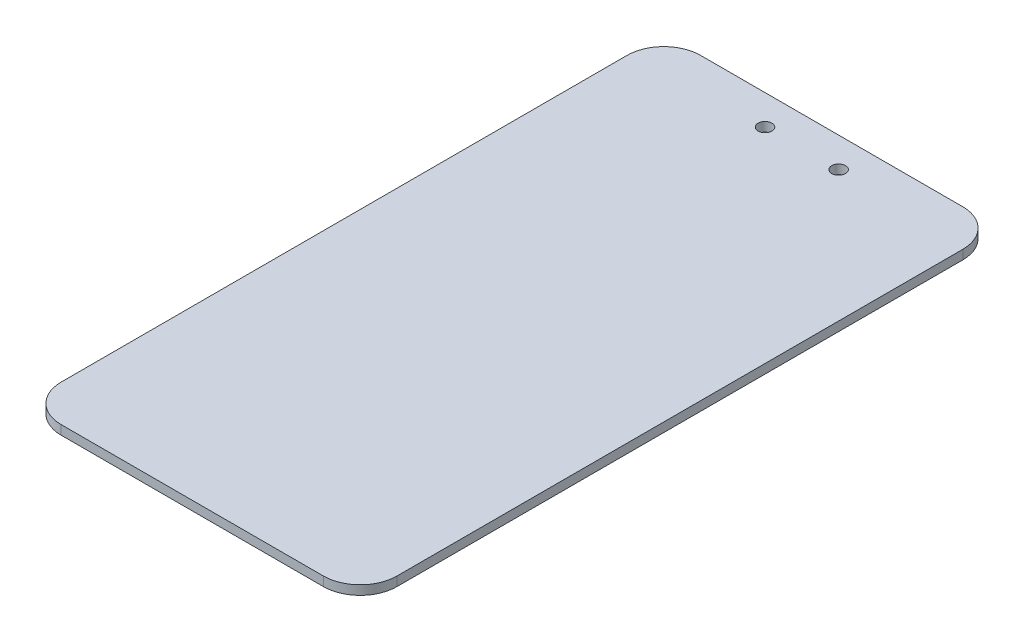
from build123d import *

# Parameters (mm, degrees)
SKETCH1_R           = 1.5
BOSS_EXTRUDE1_DEPTH = 2


with BuildPart() as part:
    # Sketch1 → Boss-Extrude1 (new body)
    with BuildSketch(Plane(origin=(0, 0, 0), x_dir=(1, 0, 0), z_dir=(0, 1, 0))):
        with BuildLine():
            Line((8, 0), (65, 0))
            ThreePointArc((65, 0), (70.656854249, 2.343145751), (73, 8))
            Line((73, 8), (73, 131))
            ThreePointArc((73, 131), (70.656854249, 136.656854249), (65, 139))
            Line((65, 139), (8, 139))
            ThreePointArc((8, 139), (2.343145751, 136.656854249), (0, 131))
            Line((0, 131), (0, 8))
            ThreePointArc((0, 8), (2.343145751, 2.343145751), (8, 0))
        make_face()
        with Locations(Location((44.5, 132.5, 0), (0, 0, 270))):
            Circle(SKETCH1_R, mode=Mode.SUBTRACT)
        with Locations(Location((28.5, 132.5, 0), (0, 0, 90))):
            Circle(SKETCH1_R, mode=Mode.SUBTRACT)
    extrude(amount=BOSS_EXTRUDE1_DEPTH)


solid = part.part
